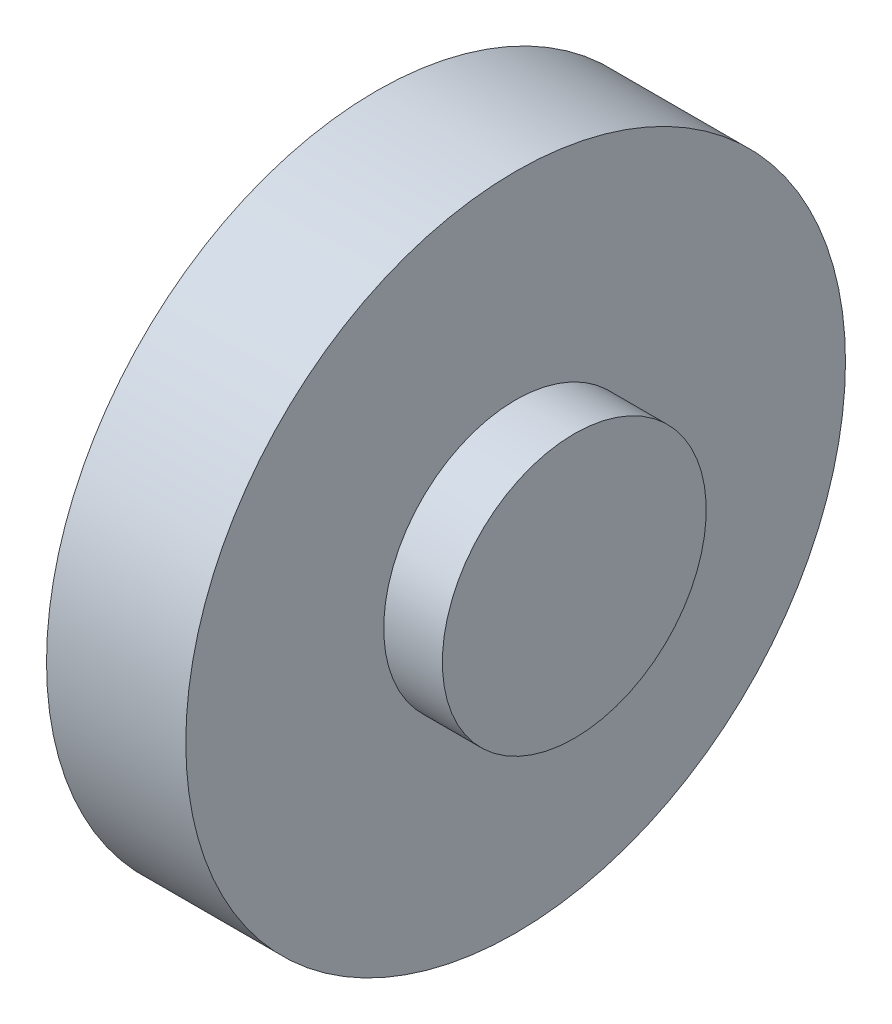
from build123d import *


with BuildPart() as part:
    # Sketch2 → Revolve1 (revolve)
    with BuildSketch(Plane.XY, mode=Mode.PRIVATE) as revolve1_sk:
        Polygon((0, 0), (0, 10), (10, 10), (10, 45), (29, 45), (29, 18), (37, 18), (37, 0), align=None)
    revolve(revolve1_sk.sketch.rotate(Axis((-78.877853563, 0, 0), (1, 0, 0)), 180), axis=Axis((-78.877853563, 0, 0), (1, 0, 0)))


solid = part.part
